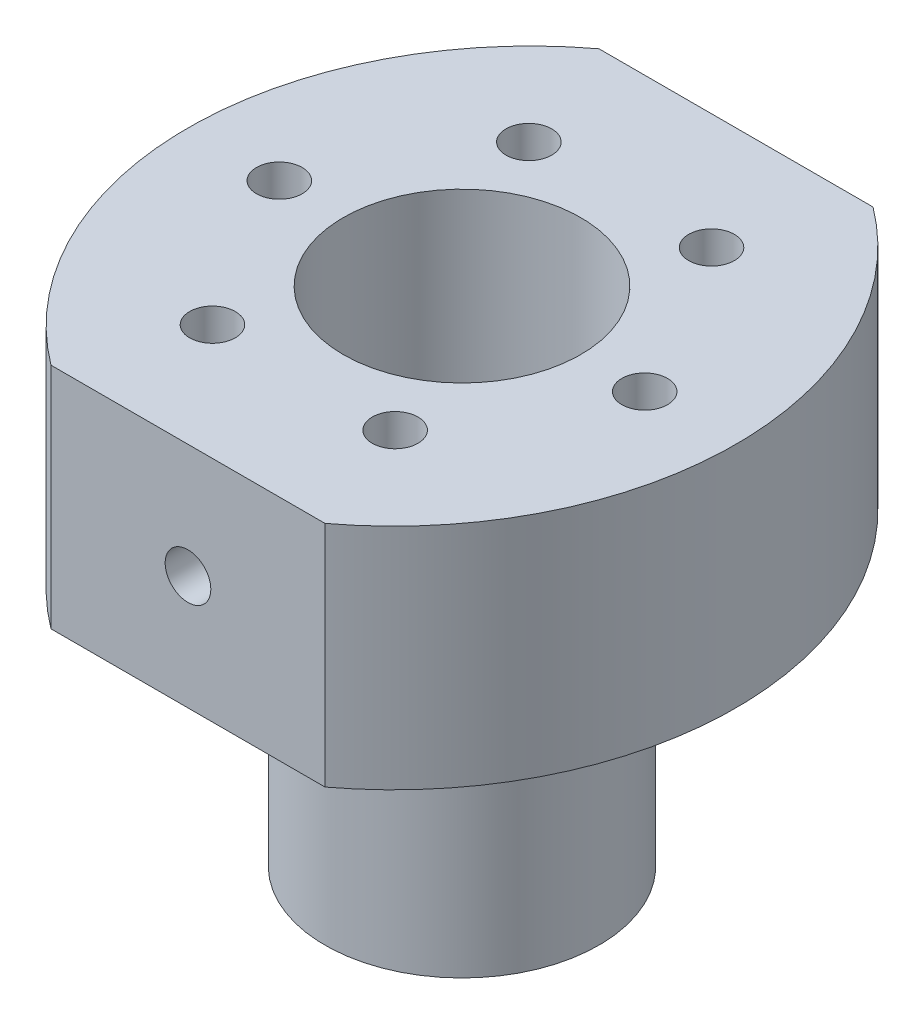
from build123d import *

# Parameters (mm, degrees)
SALIENTE_EXTRUIR2_DEPTH = 12.5
CROQUIS31_R             = 15
SALIENTE_EXTRUIR3_DEPTH = 30
CROQUIS8_R              = 13
CORTAR_EXTRUIR2_DEPTH   = 100
CROQUIS33_R             = 2.5
CORTAR_EXTRUIR9_DEPTH   = 2.5
CORTAR_EXTRUIR10_START  = -5
CROQUIS34_R             = 2.5
CORTAR_EXTRUIR10_DEPTH  = 5
CROQUIS35_R             = 2.5
CORTAR_EXTRUIR11_DEPTH  = 25


with BuildPart() as part:
    # Croquis1 → Saliente-Extruir2 (new, symmetric)
    with BuildSketch(Plane(origin=(0, 0, 0), x_dir=(1, 0, 0), z_dir=(0, 1, 0))):
        with BuildLine():
            Line((-15, -30), (15, -30))
            ThreePointArc((15, -30), (30, 0), (15, 30))
            Line((15, 30), (-15, 30))
            ThreePointArc((-15, 30), (-30, 0), (-15, -30))
        make_face()
    extrude(amount=SALIENTE_EXTRUIR2_DEPTH, both=True)

    # Croquis31 → Saliente-Extruir3 (add)
    with BuildSketch(Plane(origin=(0, -12.5, 0), x_dir=(-1, 0, 0), z_dir=(0, -1, 0))):
        with Locations(Location((0, 0, 0), (0, 0, 90))):
            Circle(CROQUIS31_R)
    extrude(amount=SALIENTE_EXTRUIR3_DEPTH)

    # Croquis8 → Cortar-Extruir2 (cut)
    with BuildSketch(Plane(origin=(0, 12.5, 0), x_dir=(1, 0, 0), z_dir=(0, 1, 0))):
        with Locations(Location((0, 0, 0), (0, 0, 270))):
            Circle(CROQUIS8_R)
    extrude(amount=-CORTAR_EXTRUIR2_DEPTH, mode=Mode.SUBTRACT)

    # Croquis33 → Cortar-Extruir9 (cut, symmetric)
    with BuildSketch(Plane(origin=(0, 0, -30), x_dir=(-1, 0, 0), z_dir=(0, 0, -1))):
        Circle(CROQUIS33_R)
    extrude(amount=CORTAR_EXTRUIR9_DEPTH, both=True, mode=Mode.SUBTRACT)

    # Croquis34 → Cortar-Extruir10 (cut)
    with BuildSketch(Plane.XY.offset(30).offset(CORTAR_EXTRUIR10_START)):
        with Locations(Location((0, 0, 0), (0, 0, 180))):
            Circle(CROQUIS34_R)
    extrude(amount=CORTAR_EXTRUIR10_DEPTH, mode=Mode.SUBTRACT)

    # Croquis35 → Cortar-Extruir11 (cut)
    with BuildSketch(Plane(origin=(0, 12.5, 0), x_dir=(1, 0, 0), z_dir=(0, 1, 0))):
        with Locations(Location((20, 0, 0), (0, 0, 270))):
            Circle(CROQUIS35_R)
        with Locations(Location((-20, 0, 0), (0, 0, 270))):
            Circle(CROQUIS35_R)
        with Locations(Location((-10, 17.320508076, 0), (0, 0, 270))):
            Circle(CROQUIS35_R)
        with Locations(Location((10, 17.320508076, 0), (0, 0, 270))):
            Circle(CROQUIS35_R)
        with Locations(Location((10, -17.320508076, 0), (0, 0, 270))):
            Circle(CROQUIS35_R)
        with Locations(Location((-10, -17.320508076, 0), (0, 0, 270))):
            Circle(CROQUIS35_R)
    extrude(amount=-CORTAR_EXTRUIR11_DEPTH, mode=Mode.SUBTRACT)


solid = part.part
